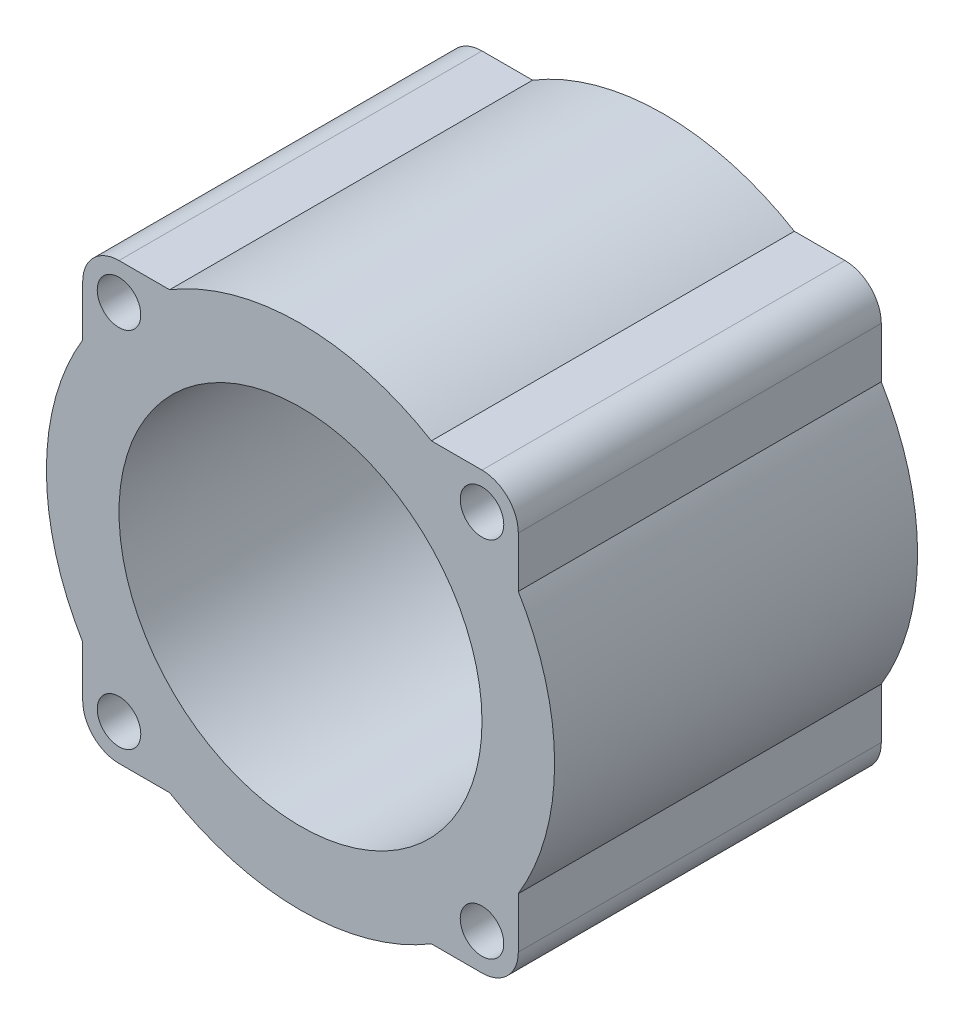
from build123d import *

# Parameters (mm, degrees)
SKETCH1_R           = 0.6
SKETCH1_R_2         = 5
BOSS_EXTRUDE1_DEPTH = 10


with BuildPart() as part:
    # Sketch1 → Boss-Extrude1 (new body)
    with BuildSketch(Plane.XY):
        with BuildLine():
            Line((3.605551275, 6), (5, 6))
            ThreePointArc((5, 6), (5.707106781, 5.707106781), (6, 5))
            Line((6, 5), (6, 3.605551275))
            ThreePointArc((6, 3.605551275), (7, 0), (6, -3.605551275))
            Line((6, -3.605551275), (6, -5))
            ThreePointArc((6, -5), (5.707106781, -5.707106781), (5, -6))
            Line((5, -6), (3.605551275, -6))
            ThreePointArc((3.605551275, -6), (0, -7), (-3.605551275, -6))
            Line((-3.605551275, -6), (-5, -6))
            ThreePointArc((-5, -6), (-5.707106781, -5.707106781), (-6, -5))
            Line((-6, -5), (-6, -3.605551275))
            ThreePointArc((-6, -3.605551275), (-7, 0), (-6, 3.605551275))
            Line((-6, 3.605551275), (-6, 5))
            ThreePointArc((-6, 5), (-5.707106781, 5.707106781), (-5, 6))
            Line((-5, 6), (-3.605551275, 6))
            ThreePointArc((-3.605551275, 6), (0, 7), (3.605551275, 6))
        make_face()
        with Locations((5, 5)):
            Circle(SKETCH1_R, mode=Mode.SUBTRACT)
        with Locations(Location((-5, 5, 0), (0, 0, 180))):
            Circle(SKETCH1_R, mode=Mode.SUBTRACT)
        with Locations(Location((5, -5, 0), (0, 0, 180))):
            Circle(SKETCH1_R, mode=Mode.SUBTRACT)
        with Locations((-5, -5)):
            Circle(SKETCH1_R, mode=Mode.SUBTRACT)
        Circle(SKETCH1_R_2, mode=Mode.SUBTRACT)
    extrude(amount=BOSS_EXTRUDE1_DEPTH)


solid = part.part
